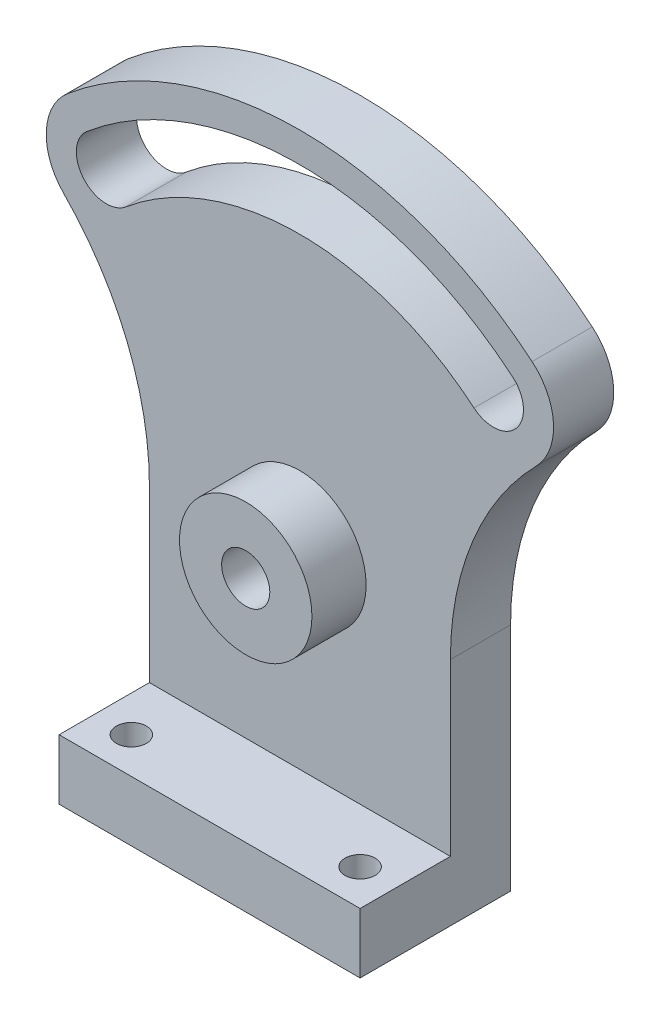
from build123d import *

# Parameters (mm, degrees)
SKETCH1_W             = 50
SKETCH1_H             = 10
BOSS_EXTRUDE1_DEPTH   = 25
SKETCH1_3_R           = 11
SKETCH1_3_R_2         = 4
BOSS_EXTRUDE2_DEPTH   = 10
SKETCH1_4_R           = 11
SKETCH1_4_R_2         = 4
BOSS_EXTRUDE3_DEPTH   = 19
F_5_0MM_DOWEL_HOLE1_D = 5


with BuildPart() as part:
    # Sketch1 → Boss-Extrude1 (new body)
    with BuildSketch(Plane.XY):
        with Locations((0, -16)):
            Rectangle(SKETCH1_W, SKETCH1_H)
    extrude(amount=BOSS_EXTRUDE1_DEPTH)

    # Sketch1<3> → Boss-Extrude2 (add)
    # profile 1 of 3: a face of its own
    with BuildSketch(Plane.XY):
        with BuildLine():
            Line((-25, 17.314518066), (-25, -11))
            Line((-25, -11), (25, -11))
            Line((25, -11), (25, 17.314518066))
            ThreePointArc((25, 17.314518066), (28.70821268, 36.210825292), (39.28281707, 52.304271474))
            ThreePointArc((39.28281707, 52.304271474), (32.626957345, 49.314115789), (25.711504387, 51.641777725))
            ThreePointArc((25.711504387, 51.641777725), (0, 61), (-25.711504387, 51.641777725))
            ThreePointArc((-25.711504387, 51.641777725), (-32.626957345, 49.314115789), (-39.28281707, 52.304271474))
            ThreePointArc((-39.28281707, 52.304271474), (-28.70821268, 36.210825292), (-25, 17.314518066))
        make_face()
        with Locations((0, 21)):
            Circle(SKETCH1_3_R, mode=Mode.SUBTRACT)
    # profile 2 of 3: a face of its own
    with BuildSketch(Plane.XY):
        with Locations((0, 21)):
            Circle(SKETCH1_3_R_2)
    # profile 3 of 3: a face of its own
    with BuildSketch(Plane.XY):
        with BuildLine():
            ThreePointArc((38.567256581, 66.962666587), (0, 81), (-38.567256581, 66.962666587))
            ThreePointArc((-38.567256581, 66.962666587), (-39.799824916, 52.874346059), (-25.711504387, 51.641777725))
            ThreePointArc((-25.711504387, 51.641777725), (0, 61), (25.711504387, 51.641777725))
            ThreePointArc((25.711504387, 51.641777725), (39.799824916, 52.874346059), (38.567256581, 66.962666587))
        make_face()
        with BuildLine():
            ThreePointArc((-35.353318533, 63.132444372), (-35.9696027, 56.088284108), (-28.925442436, 55.47199994))
            ThreePointArc((-28.925442436, 55.47199994), (0, 66), (28.925442436, 55.47199994))
            ThreePointArc((28.925442436, 55.47199994), (35.9696027, 56.088284108), (35.353318533, 63.132444372))
            ThreePointArc((35.353318533, 63.132444372), (0, 76), (-35.353318533, 63.132444372))
        make_face(mode=Mode.SUBTRACT)
    extrude(amount=BOSS_EXTRUDE2_DEPTH)


with BuildPart() as boss_extrude2_piece_1:
    # of the separate pieces the step leaves, piece 1, a body of its own (boss_extrude2_pieces)
    add(part.part.solids().sort_by_distance((-25, -11, 10))[0])



with BuildPart() as boss_extrude2_piece_2:
    # of the separate pieces the step leaves, piece 2, a body of its own (boss_extrude2_pieces)
    add(part.part.solids().sort_by_distance((4, 21, 0))[0])


with BuildPart() as boss_extrude2_piece_1_1:
    add(boss_extrude2_piece_1.part)

    add(boss_extrude2_piece_2.part)  # Boss-Extrude3 merges Boss-Extrude2 piece 2
    # Sketch1<4> → Boss-Extrude3 (add)
    with BuildSketch(Plane.XY):
        with Locations((0, 21)):
            Circle(SKETCH1_4_R)
        with Locations((0, 21)):
            Circle(SKETCH1_4_R_2, mode=Mode.SUBTRACT)
    extrude(amount=BOSS_EXTRUDE3_DEPTH)

    # Ø5.0mm Dowel Hole1 (through all)
    with Locations(Plane(origin=(-19, -11, 19), x_dir=(0, 0, 1), z_dir=(0, 1, 0))):
        with Locations((0, 0), (0, 38)):
            Hole(F_5_0MM_DOWEL_HOLE1_D / 2)


solid = boss_extrude2_piece_1_1.part
